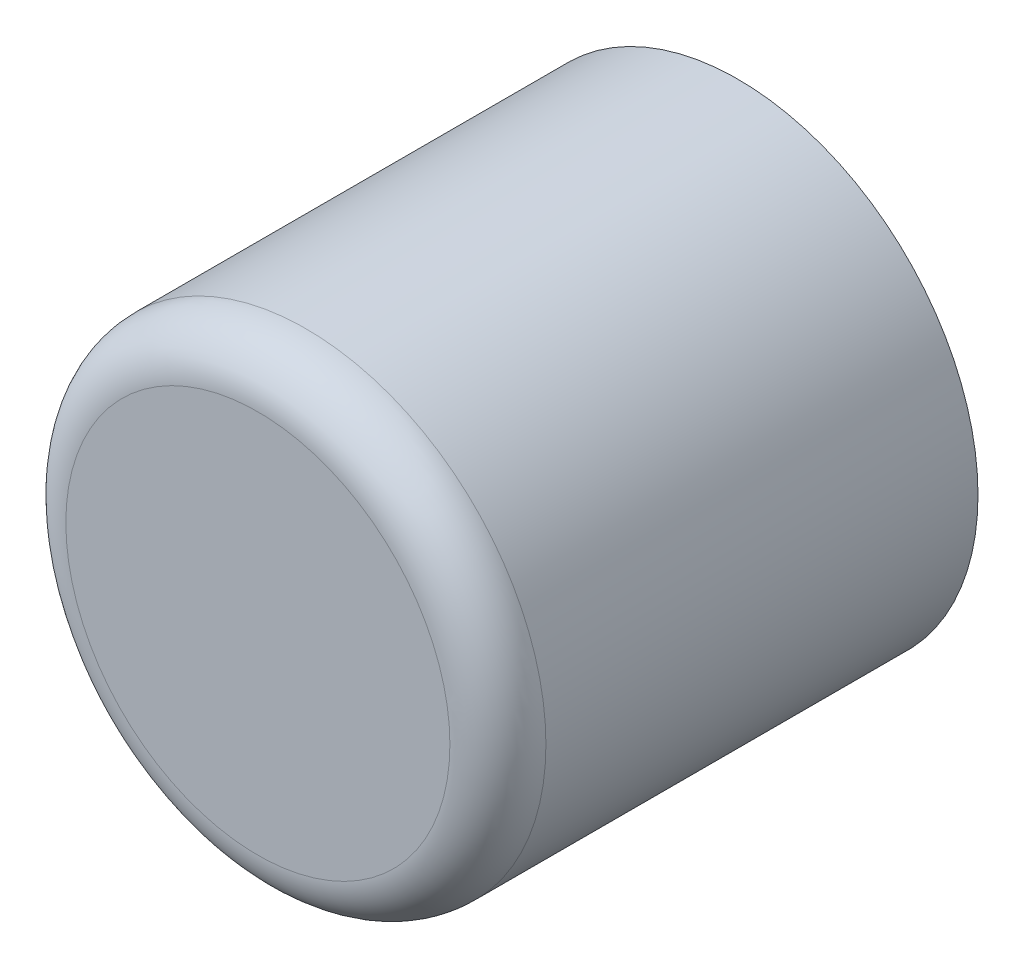
from build123d import *

# Parameters (mm, degrees)
SKETCH_MAIN_PROFILE_R  = 10
FEATURE_CYLINDER_DEPTH = 20
FEATURE_TOP_FILLET_R   = 2


with BuildPart() as part:
    # sketch:main-profile → feature:cylinder (new body)
    with BuildSketch(Plane.XY):
        Circle(SKETCH_MAIN_PROFILE_R)
    extrude(amount=FEATURE_CYLINDER_DEPTH)

    # feature:top-fillet
    feature_top_fillet_edges = [part.edges().sort_by_distance(p)[0] for p in [
        (-10, 0, 20),
    ]]
    fillet(feature_top_fillet_edges, radius=FEATURE_TOP_FILLET_R)


solid = part.part
